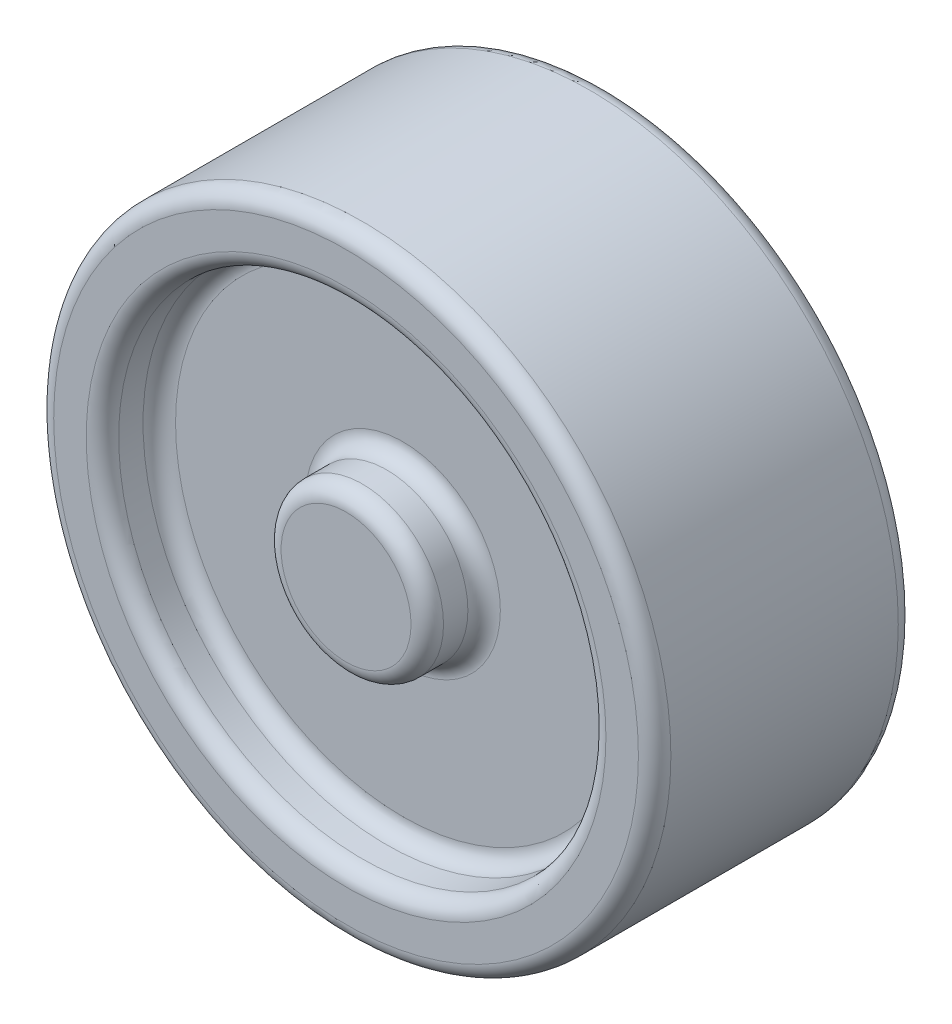
from build123d import *

# Parameters (mm, degrees)
SKETCH_1_R          = 19
EXTRUDE_1_DEPTH     = 8
FILLET_1_R          = 1
SKETCH_2_R          = 15
SKETCH_2_R_2        = 5
CUT_EXTRUDE_1_DEPTH = 3.5
FILLET_2_R          = 1


with BuildPart() as part:
    # ｽｹｯﾁ1 → ﾎﾞｽ - 押し出し1 (new, symmetric)
    with BuildSketch(Plane.XY):
        Circle(SKETCH_1_R)
    extrude(amount=EXTRUDE_1_DEPTH, both=True)

    # ﾌｨﾚｯﾄ1
    fillet_1_edges = [part.edges().sort_by_distance(p)[0] for p in [
        (-19, 0, -8),
        (-19, 0, 8),
    ]]
    fillet(fillet_1_edges, radius=FILLET_1_R)

    # ｽｹｯﾁ2 → ｶｯﾄ - 押し出し1 (cut)
    with BuildSketch(Plane.XY.offset(8)):
        Circle(SKETCH_2_R)
        Circle(SKETCH_2_R_2, mode=Mode.SUBTRACT)
    cut_extrude_1 = extrude(amount=-CUT_EXTRUDE_1_DEPTH, mode=Mode.SUBTRACT)

    # ﾐﾗｰ1: ｶｯﾄ - 押し出し1 across plane
    add(cut_extrude_1.mirror(Plane.XY), mode=Mode.SUBTRACT)

    # ﾌｨﾚｯﾄ2
    fillet_2_edges = [part.edges().sort_by_distance(p)[0] for p in [
        (-15, 0, 4.5),
        (-5, 0, 4.5),
        (-15, 0, 8),
        (-5, 0, 8),
        (-15, 0, -4.5),
        (-5, 0, -8),
        (-15, 0, -8),
        (-5, 0, -4.5),
    ]]
    fillet(fillet_2_edges, radius=FILLET_2_R)


solid = part.part
